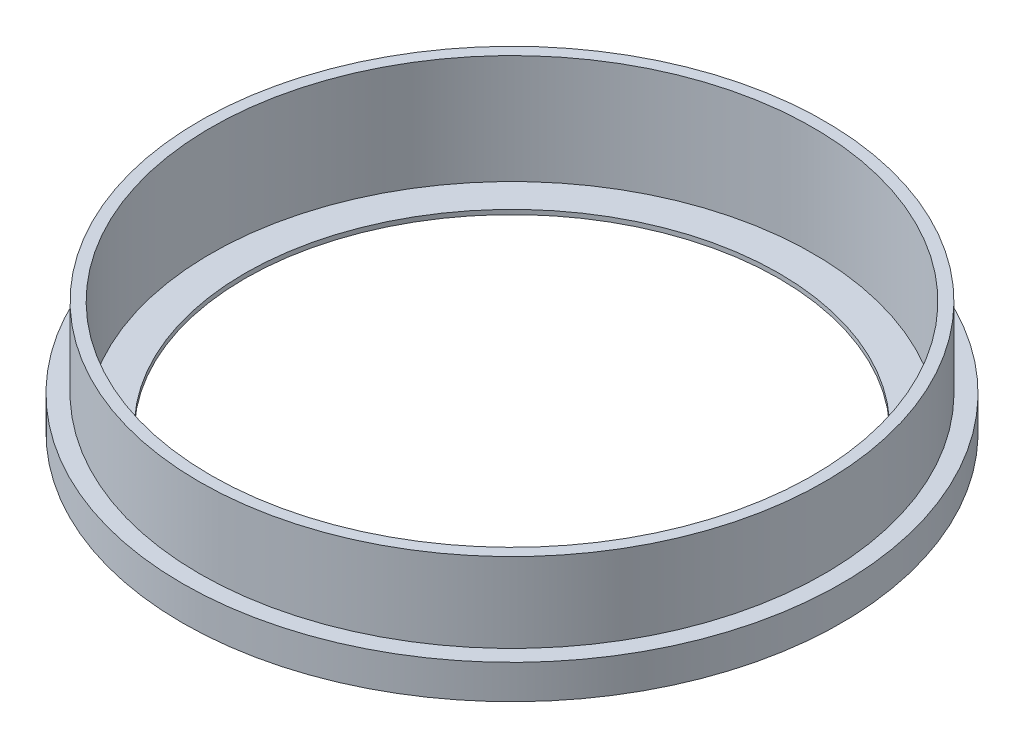
from build123d import *

# Parameters (mm, degrees)
SKETCH1_R           = 27.5
BOSS_EXTRUDE1_DEPTH = 10
SKETCH2_R           = 29
SKETCH2_R_2         = 24
EXTRUDE_THIN1_DEPTH = 3
SKETCH3_R           = 26.5
CUT_EXTRUDE1_DEPTH  = 9.6
SKETCH4_R           = 23.5
CUT_EXTRUDE2_DEPTH  = 43.12077872


with BuildPart() as part:
    # Sketch1 → Boss-Extrude1 (new body)
    with BuildSketch(Plane(origin=(0, 0, 0), x_dir=(1, 0, 0), z_dir=(0, 1, 0))):
        with Locations(Location((0, 0, 0), (0, 0, 270))):
            Circle(SKETCH1_R)
    extrude(amount=BOSS_EXTRUDE1_DEPTH)

    # Sketch2 → Extrude-Thin1 (add)
    with BuildSketch(Plane(origin=(0, 0, 0), x_dir=(1, 0, 0), z_dir=(0, 1, 0))):
        Circle(SKETCH2_R)
        Circle(SKETCH2_R_2, mode=Mode.SUBTRACT)
    extrude(amount=EXTRUDE_THIN1_DEPTH)

    # Sketch3 → Cut-Extrude1 (cut)
    with BuildSketch(Plane(origin=(0, 10, 0), x_dir=(1, 0, 0), z_dir=(0, 1, 0))):
        with Locations(Location((0, 0, 0), (0, 0, 270))):
            Circle(SKETCH3_R)
    extrude(amount=-CUT_EXTRUDE1_DEPTH, mode=Mode.SUBTRACT)

    # Sketch4 → Cut-Extrude2 (cut, through all)
    with BuildSketch(Plane(origin=(0, 0.4, 0), x_dir=(1, 0, 0), z_dir=(0, 1, 0))):
        with Locations(Location((0, 0, 0), (0, 0, 270))):
            Circle(SKETCH4_R)
    extrude(amount=-CUT_EXTRUDE2_DEPTH, mode=Mode.SUBTRACT)


solid = part.part
